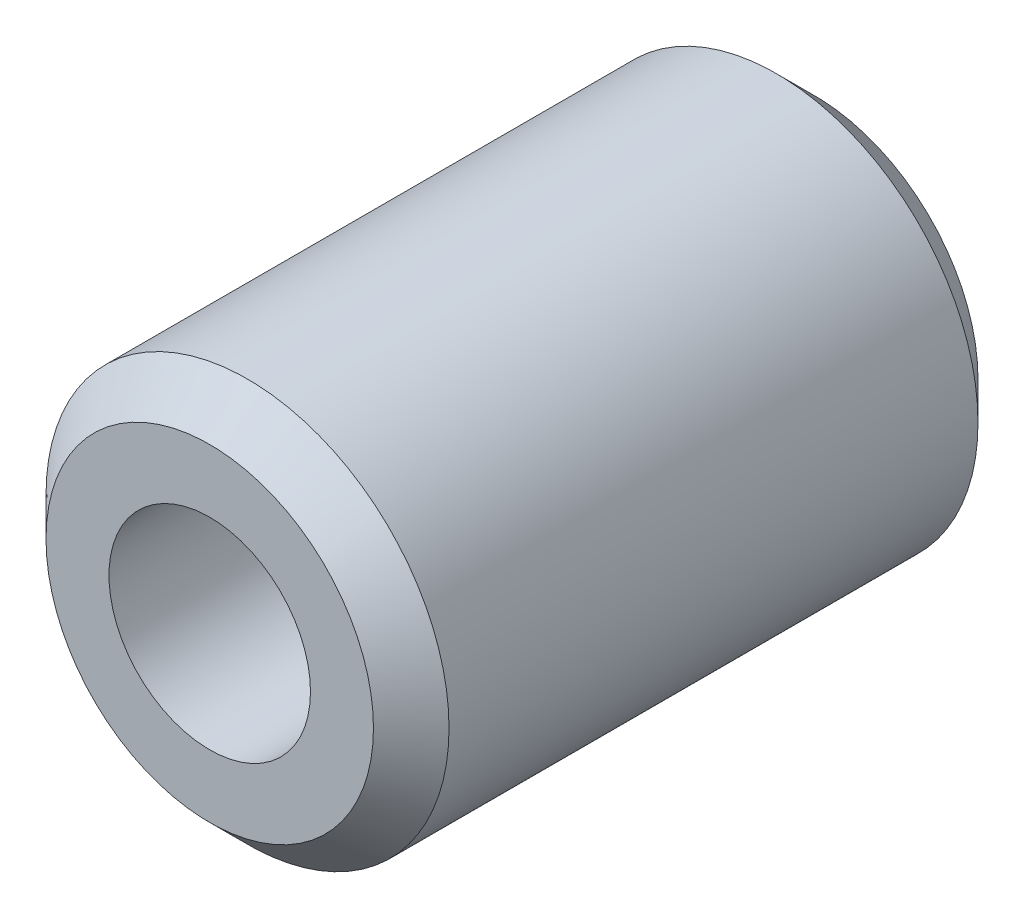
from build123d import *

# Parameters (mm, degrees)
SKETCH3_W     = 9.525
SKETCH3_H     = 1.5875
CHAMFER1_SIZE = 0.5953125


with BuildPart() as part:
    # Sketch3 → Revolve1 (revolve)
    with BuildSketch(Plane(origin=(0, 0, 0), x_dir=(0, 0, -1), z_dir=(1, 0, 0)), mode=Mode.PRIVATE) as revolve1_sk:
        with Locations((0, 2.38125)):
            Rectangle(SKETCH3_W, SKETCH3_H)
    revolve(revolve1_sk.sketch.rotate(Axis((0, 0, 4.7625), (0, 0, -1)), 90), axis=Axis((0, 0, 4.7625), (0, 0, -1)))

    # Chamfer1
    chamfer1_edges = [part.edges().sort_by_distance(p)[0] for p in [
        (-3.175, 0, 4.7625),
        (-3.175, 0, -4.7625),
    ]]
    chamfer(chamfer1_edges, length=CHAMFER1_SIZE)


solid = part.part
